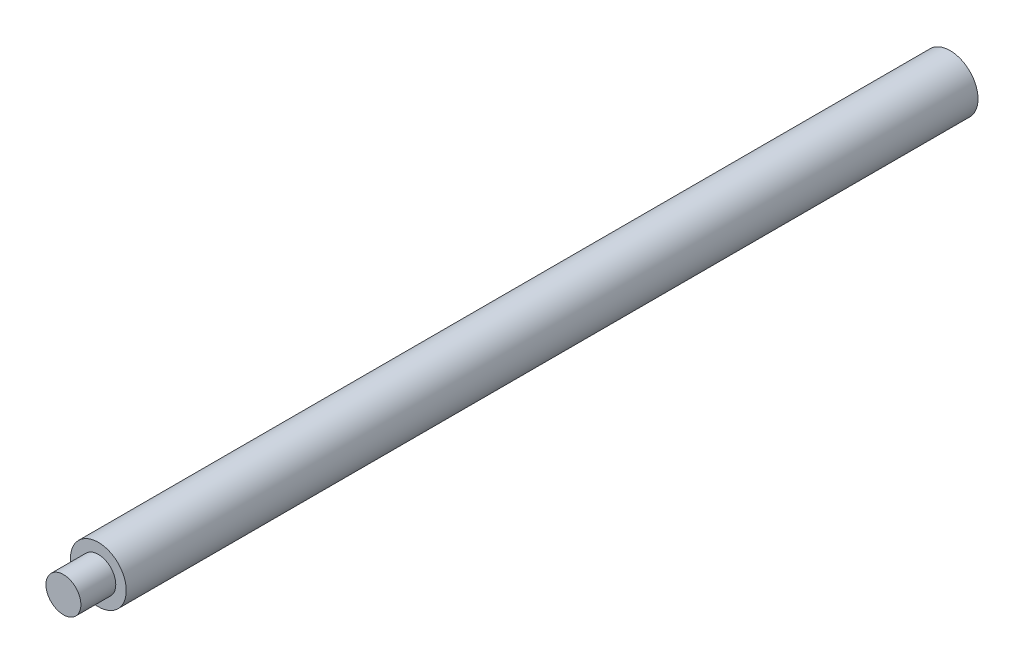
from build123d import *

# Parameters (mm, degrees)
SKETCH_2_R          = 4
EXTRUDE_1_DEPTH     = 127
CUT_EXTRUDE_START   = -5
SKETCH_3_R          = 4
SKETCH_3_R_2        = 2.5
CUT_EXTRUDE_1_DEPTH = 5


with BuildPart() as part:
    # 草圖2 → 填料-伸長1 (new body)
    with BuildSketch(Plane.XY):
        Circle(SKETCH_2_R)
    extrude(amount=EXTRUDE_1_DEPTH)

    # 草圖3 → 除料-伸長1 (cut)
    with BuildSketch(Plane.XY.offset(127).offset(CUT_EXTRUDE_START)):
        Circle(SKETCH_3_R)
        Circle(SKETCH_3_R_2, mode=Mode.SUBTRACT)
    extrude(amount=CUT_EXTRUDE_1_DEPTH, mode=Mode.SUBTRACT)


solid = part.part
